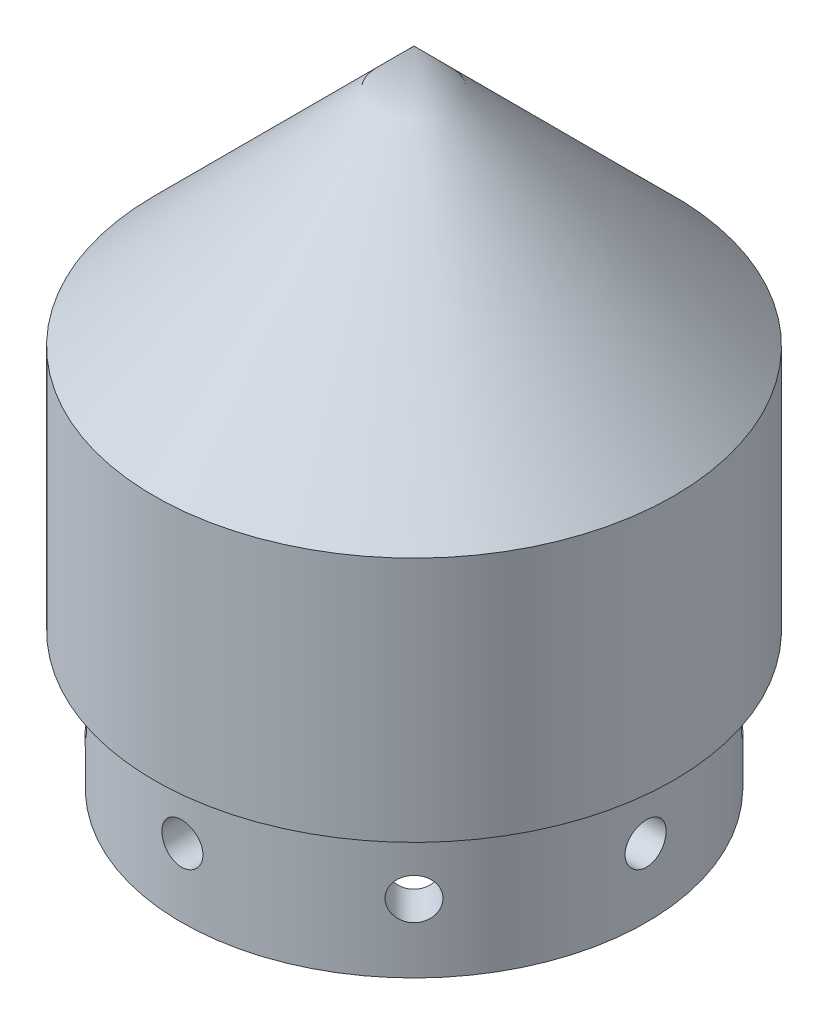
from build123d import *

# Parameters (mm, degrees)
SKETCH3_R          = 1.5
CUT_EXTRUDE1_DEPTH = 55.138710735
CIRPATTERN1_COUNT  = 8


with BuildPart() as part:
    # Sketch2 → Revolve1 (revolve)
    with BuildSketch(Plane.XY, mode=Mode.PRIVATE) as revolve1_sk:
        Polygon((17, 0), (17, 10), (19, 10), (19, 28), (0, 47), (0, 42.757359313), (16, 26.757359313), (16, 13), (14, 13), (14, 0), align=None)
    revolve(revolve1_sk.sketch.rotate(Axis((0, 26.112729166, 0), (0, -1, 0)), 180), axis=Axis((0, 26.112729166, 0), (0, -1, 0)))

    # Sketch3 → Cut-Extrude1 (cut, through all)
    with BuildSketch(Plane.XY):
        with Locations((0, 5)):
            Circle(SKETCH3_R)
    cut_extrude1 = extrude(amount=-CUT_EXTRUDE1_DEPTH, mode=Mode.SUBTRACT)

    # CirPattern1: Cut-Extrude1 ×8 about axis
    cirpattern1_axis = Axis((0, 26.112729166, 0), (0, 1, 0))
    for i in range(1, CIRPATTERN1_COUNT):
        add(cut_extrude1.rotate(cirpattern1_axis, i * 360 / CIRPATTERN1_COUNT), mode=Mode.SUBTRACT)


solid = part.part
